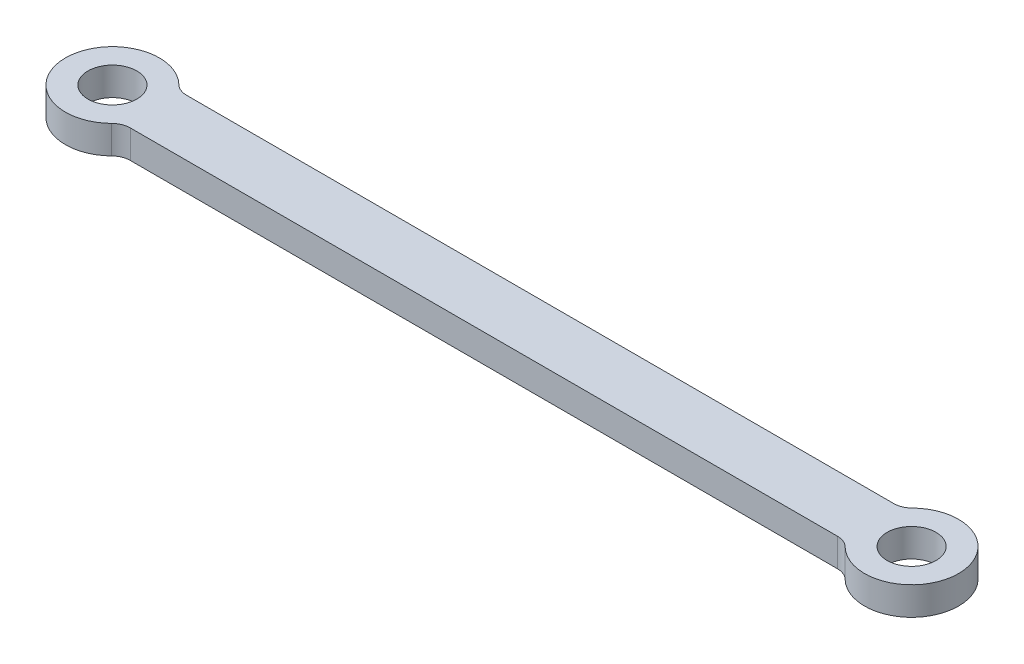
from build123d import *

# Parameters (mm, degrees)
EXTRUDE_1_DEPTH     = 3
SKETCH_2_R          = 5
EXTRUDE_2_DEPTH     = 3
SKETCH_3_R          = 2.6
CUT_EXTRUDE_1_DEPTH = 10
FILLET_1_R          = 2


with BuildPart() as part:
    # ｽｹｯﾁ1 → ﾎﾞｽ - 押し出し1 (new body)
    with BuildSketch(Plane(origin=(0, 0, 0), x_dir=(1, 0, 0), z_dir=(0, 1, 0))):
        with BuildLine():
            Line((-42.5, 3), (42.5, 3))
            ThreePointArc((42.5, 3), (45.5, 0), (42.5, -3))
            Line((42.5, -3), (-42.5, -3))
            ThreePointArc((-42.5, -3), (-45.5, 0), (-42.5, 3))
        make_face()
    extrude(amount=EXTRUDE_1_DEPTH)

    # ｽｹｯﾁ2 → ﾎﾞｽ - 押し出し2 (add)
    with BuildSketch(Plane(origin=(0, 3, 0), x_dir=(1, 0, 0), z_dir=(0, 1, 0))):
        with Locations((-42.5, 0)):
            Circle(SKETCH_2_R)
        with Locations((42.5, 0)):
            Circle(SKETCH_2_R)
    extrude(amount=-EXTRUDE_2_DEPTH)

    # ｽｹｯﾁ3 → ｶｯﾄ - 押し出し1 (cut)
    with BuildSketch(Plane(origin=(0, 3, 0), x_dir=(1, 0, 0), z_dir=(0, 1, 0))):
        with Locations(Location((-42.5, 0, 0), (0, 0, 270))):
            Circle(SKETCH_3_R)
        with Locations(Location((42.5, 0, 0), (0, 0, 270))):
            Circle(SKETCH_3_R)
    extrude(amount=-CUT_EXTRUDE_1_DEPTH, mode=Mode.SUBTRACT)

    # ﾌｨﾚｯﾄ1
    fillet_1_edges = [part.edges().sort_by_distance(p)[0] for p in [
        (-38.5, 1.5, 3),
        (-38.5, 1.5, -3),
        (38.5, 1.5, 3),
        (38.5, 1.5, -3),
    ]]
    fillet(fillet_1_edges, radius=FILLET_1_R)


solid = part.part
